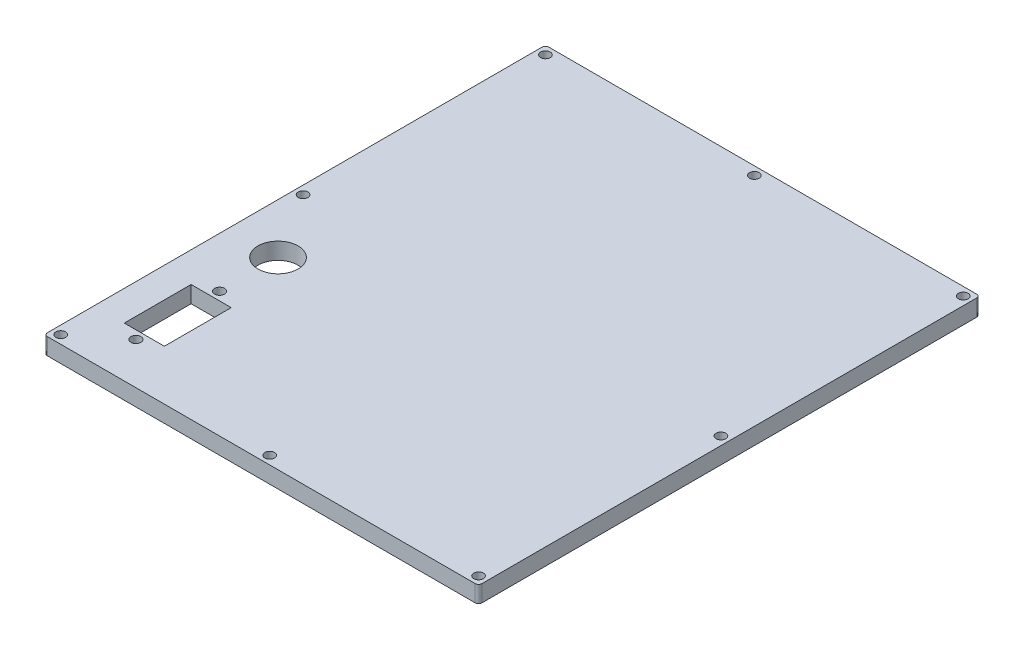
from build123d import *

# Parameters (mm, degrees)
SKETCH1_W           = 130
SKETCH1_H           = 150
SKETCH1_W_2         = 120
SKETCH1_H_2         = 140
BOSS_EXTRUDE1_DEPTH = 140
SKETCH2_W           = 130
SKETCH2_H           = 150
BOSS_EXTRUDE2_DEPTH = 5
CUT_EXTRUDE1_DEPTH  = 12
SKETCH4_W           = 130
SKETCH4_H           = 150
CUT_EXTRUDE2_DEPTH  = 140
SKETCH6_W           = 120
SKETCH6_H           = 140
BOSS_EXTRUDE3_DEPTH = 5
FILLET1_R           = 1
SKETCH7_W           = 120
SKETCH7_H           = 140
SKETCH7_W_2         = 118
SKETCH7_H_2         = 138
CUT_EXTRUDE3_DEPTH  = 1
FILLET2_R           = 1
SKETCH8_W           = 5
SKETCH8_H           = 20
SKETCH8_W_2         = 2
CUT_EXTRUDE4_DEPTH  = 10
SKETCH9_R           = 6
CUT_EXTRUDE5_DEPTH  = 10


with BuildPart() as part:
    # Sketch1 → Boss-Extrude1 (new body)
    with BuildSketch(Plane(origin=(0, 0, 0), x_dir=(1, 0, 0), z_dir=(0, 1, 0))):
        Rectangle(SKETCH1_W, SKETCH1_H)
        Rectangle(SKETCH1_W_2, SKETCH1_H_2, mode=Mode.SUBTRACT)
    extrude(amount=BOSS_EXTRUDE1_DEPTH)

    # Sketch2 → Boss-Extrude2 (add)
    with BuildSketch(Plane(origin=(0, 140, 0), x_dir=(1, 0, 0), z_dir=(0, 1, 0))):
        Rectangle(SKETCH2_W, SKETCH2_H)
    extrude(amount=BOSS_EXTRUDE2_DEPTH)

    # Sketch3 → Cut-Extrude1 (cut)
    with BuildSketch(Plane.XZ):
        with BuildLine():
            ThreePointArc((1.45, -72.5), (0, -71.05), (-1.45, -72.5))
            Line((-1.45, -72.5), (1.45, -72.5))
        make_face()
        with BuildLine():
            Line((1.45, -72.5), (-1.45, -72.5))
            ThreePointArc((-1.45, -72.5), (0, -73.95), (1.45, -72.5))
        make_face()
        with BuildLine():
            ThreePointArc((63.95, -72.5), (63.525304833, -71.474695167), (62.5, -71.05))
            Line((62.5, -71.05), (62.5, -72.5))
            Line((62.5, -72.5), (61.05, -72.5))
            ThreePointArc((61.05, -72.5), (62.5, -73.95), (63.95, -72.5))
        make_face()
        with BuildLine():
            Line((62.5, -72.5), (62.5, -71.05))
            ThreePointArc((62.5, -71.05), (61.474695167, -71.474695167), (61.05, -72.5))
            Line((61.05, -72.5), (62.5, -72.5))
        make_face()
        with BuildLine():
            ThreePointArc((63.95, 0), (63.525304833, 1.025304833), (62.5, 1.45))
            Line((62.5, 1.45), (62.5, -1.45))
            ThreePointArc((62.5, -1.45), (63.525304833, -1.025304833), (63.95, 0))
        make_face()
        with BuildLine():
            Line((62.5, -1.45), (62.5, 1.45))
            ThreePointArc((62.5, 1.45), (61.05, 0), (62.5, -1.45))
        make_face()
        with BuildLine():
            ThreePointArc((63.95, 72.5), (62.5, 73.95), (61.05, 72.5))
            Line((61.05, 72.5), (62.5, 72.5))
            Line((62.5, 72.5), (62.5, 71.05))
            ThreePointArc((62.5, 71.05), (63.525304833, 71.474695167), (63.95, 72.5))
        make_face()
        with BuildLine():
            Line((62.5, 72.5), (61.05, 72.5))
            ThreePointArc((61.05, 72.5), (61.474695167, 71.474695167), (62.5, 71.05))
            Line((62.5, 71.05), (62.5, 72.5))
        make_face()
        with BuildLine():
            ThreePointArc((1.45, 72.5), (0, 73.95), (-1.45, 72.5))
            Line((-1.45, 72.5), (1.45, 72.5))
        make_face()
        with BuildLine():
            Line((1.45, 72.5), (-1.45, 72.5))
            ThreePointArc((-1.45, 72.5), (0, 71.05), (1.45, 72.5))
        make_face()
        with BuildLine():
            Line((-62.5, 71.05), (-62.5, 72.5))
            Line((-62.5, 72.5), (-61.05, 72.5))
            ThreePointArc((-61.05, 72.5), (-63.525304833, 73.525304833), (-62.5, 71.05))
        make_face()
        with BuildLine():
            Line((-61.05, 72.5), (-62.5, 72.5))
            Line((-62.5, 72.5), (-62.5, 71.05))
            ThreePointArc((-62.5, 71.05), (-61.474695167, 71.474695167), (-61.05, 72.5))
        make_face()
        with BuildLine():
            ThreePointArc((-61.05, 0), (-61.474695167, 1.025304833), (-62.5, 1.45))
            Line((-62.5, 1.45), (-62.5, -1.45))
            ThreePointArc((-62.5, -1.45), (-61.474695167, -1.025304833), (-61.05, 0))
        make_face()
        with BuildLine():
            Line((-62.5, -1.45), (-62.5, 1.45))
            ThreePointArc((-62.5, 1.45), (-63.95, 0), (-62.5, -1.45))
        make_face()
        with BuildLine():
            ThreePointArc((-61.05, -72.5), (-61.474695167, -71.474695167), (-62.5, -71.05))
            Line((-62.5, -71.05), (-62.5, -72.5))
            Line((-62.5, -72.5), (-61.05, -72.5))
        make_face()
        with BuildLine():
            Line((-62.5, -72.5), (-62.5, -71.05))
            ThreePointArc((-62.5, -71.05), (-63.525304833, -73.525304833), (-61.05, -72.5))
            Line((-61.05, -72.5), (-62.5, -72.5))
        make_face()
    extrude(amount=-CUT_EXTRUDE1_DEPTH, mode=Mode.SUBTRACT)

    # Sketch4 → Cut-Extrude2 (cut)
    with BuildSketch(Plane(origin=(0, 145, 0), x_dir=(1, 0, 0), z_dir=(0, 1, 0))):
        Rectangle(SKETCH4_W, SKETCH4_H)
    extrude(amount=-CUT_EXTRUDE2_DEPTH, mode=Mode.SUBTRACT)

    # Sketch6 → Boss-Extrude3 (add)
    with BuildSketch(Plane.XZ):
        Rectangle(SKETCH6_W, SKETCH6_H)
    extrude(amount=-BOSS_EXTRUDE3_DEPTH)

    # Fillet1
    fillet1_edges = [part.edges().sort_by_distance(p)[0] for p in [
        (-65, 2.5, -75),
        (65, 2.5, -75),
        (65, 2.5, 75),
        (-65, 2.5, 75),
    ]]
    fillet(fillet1_edges, radius=FILLET1_R)

    # Sketch7 → Cut-Extrude3 (cut)
    with BuildSketch(Plane.XZ):
        Rectangle(SKETCH7_W, SKETCH7_H)
        Rectangle(SKETCH7_W_2, SKETCH7_H_2, mode=Mode.SUBTRACT)
    extrude(amount=-CUT_EXTRUDE3_DEPTH, mode=Mode.SUBTRACT)

    # Fillet2
    fillet2_edges = [part.edges().sort_by_distance(p)[0] for p in [
        (60, 0.5, -70),
        (-60, 0.5, -70),
        (-60, 0.5, 70),
        (59, 0.5, -69),
        (59, 0.5, 69),
        (-59, 0.5, 69),
        (-59, 0.5, -69),
        (60, 0.5, 70),
    ]]
    fillet(fillet2_edges, radius=FILLET2_R)

    # Sketch8 → Cut-Extrude4 (cut)
    with BuildSketch(Plane.XZ):
        with Locations((-53.5, 50)):
            Rectangle(SKETCH8_W, SKETCH8_H)
        with Locations((-50, 50)):
            Rectangle(SKETCH8_W_2, SKETCH8_H)
        with Locations((-46.5, 50)):
            Rectangle(SKETCH8_W, SKETCH8_H)
        with BuildLine():
            Line((-51, 61.381966011), (-51, 62.5))
            Line((-51, 62.5), (-49, 62.5))
            Line((-49, 62.5), (-49, 61.381966011))
            ThreePointArc((-49, 61.381966011), (-48.630693606, 61.887627564), (-48.5, 62.5))
            ThreePointArc((-48.5, 62.5), (-50.612372436, 63.869306394), (-51, 61.381966011))
        make_face()
        with BuildLine():
            Line((-49, 62.5), (-51, 62.5))
            Line((-51, 62.5), (-51, 61.381966011))
            ThreePointArc((-51, 61.381966011), (-50, 61), (-49, 61.381966011))
            Line((-49, 61.381966011), (-49, 62.5))
        make_face()
        with BuildLine():
            ThreePointArc((-49, 38.618033989), (-50, 39), (-51, 38.618033989))
            Line((-51, 38.618033989), (-51, 37.5))
            Line((-51, 37.5), (-49, 37.5))
            Line((-49, 37.5), (-49, 38.618033989))
        make_face()
        with BuildLine():
            Line((-51, 37.5), (-51, 38.618033989))
            ThreePointArc((-51, 38.618033989), (-50.612372436, 36.130693606), (-48.5, 37.5))
            ThreePointArc((-48.5, 37.5), (-48.630693606, 38.112372436), (-49, 38.618033989))
            Line((-49, 38.618033989), (-49, 37.5))
            Line((-49, 37.5), (-51, 37.5))
        make_face()
    extrude(amount=-CUT_EXTRUDE4_DEPTH, mode=Mode.SUBTRACT)

    # Sketch9 → Cut-Extrude5 (cut)
    with BuildSketch(Plane.XZ):
        with Locations(Location((-50, 20, 0), (0, 0, 270))):
            Circle(SKETCH9_R)
    extrude(amount=-CUT_EXTRUDE5_DEPTH, mode=Mode.SUBTRACT)


solid = part.part
